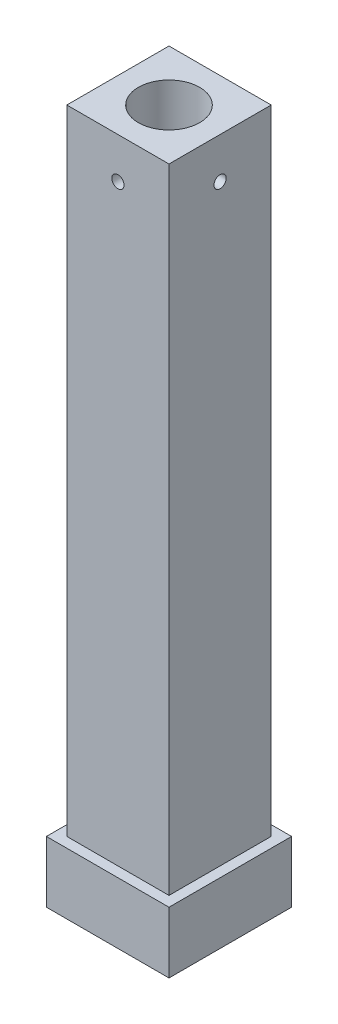
from build123d import *

# Parameters (mm, degrees)
SKETCH_1_W          = 5
SKETCH_1_H          = 5
EXTRUDE_1_DEPTH     = 34
SKETCH_1_5_W        = 6
SKETCH_1_5_H        = 6
EXTRUDE_2_DEPTH     = 3
SKETCH_1_3_R        = 1.5
CUT_EXTRUDE_1_DEPTH = 35.263683398
CUT_EXTRUDE_2_DEPTH = 2
SKETCH_3_R          = 0.3
CUT_EXTRUDE_3_DEPTH = 35.572387826
SKETCH_4_R          = 0.3
CUT_EXTRUDE_4_DEPTH = 35.572387924


with BuildPart() as part:
    # 草图1 → 凸台-拉伸1 (new body)
    with BuildSketch(Plane(origin=(0, 0, 0), x_dir=(1, 0, 0), z_dir=(0, 1, 0))):
        Rectangle(SKETCH_1_W, SKETCH_1_H)
    extrude(amount=EXTRUDE_1_DEPTH)

    # 草图1<5> → 凸台-拉伸2 (add)
    with BuildSketch(Plane(origin=(0, 0, 0), x_dir=(1, 0, 0), z_dir=(0, 1, 0))):
        Rectangle(SKETCH_1_5_W, SKETCH_1_5_H)
    extrude(amount=EXTRUDE_2_DEPTH)

    # 草图1<3> → 切除-拉伸1 (cut, through all)
    with BuildSketch(Plane(origin=(0, 0, 0), x_dir=(1, 0, 0), z_dir=(0, 1, 0))):
        Circle(SKETCH_1_3_R)
    extrude(amount=CUT_EXTRUDE_1_DEPTH, mode=Mode.SUBTRACT)

    # 草图1<4> → 切除-拉伸2 (cut)
    with BuildSketch(Plane(origin=(0, 0, 0), x_dir=(1, 0, 0), z_dir=(0, 1, 0))):
        Polygon((2.886751346, 0), (1.443375673, 2.5), (-1.443375673, 2.5), (-2.886751346, 0), (-1.443375673, -2.5), (1.443375673, -2.5), align=None)
    extrude(amount=CUT_EXTRUDE_2_DEPTH, mode=Mode.SUBTRACT)

    # 草图3 → 切除-拉伸3 (cut, through all)
    with BuildSketch(Plane.XY.offset(2.5)):
        with Locations((0, 32)):
            Circle(SKETCH_3_R)
    extrude(amount=-CUT_EXTRUDE_3_DEPTH, mode=Mode.SUBTRACT)

    # 草图4 → 切除-拉伸4 (cut, through all)
    with BuildSketch(Plane.ZY.offset(2.5)):
        with Locations((0, 32)):
            Circle(SKETCH_4_R)
    extrude(amount=-CUT_EXTRUDE_4_DEPTH, mode=Mode.SUBTRACT)


solid = part.part
